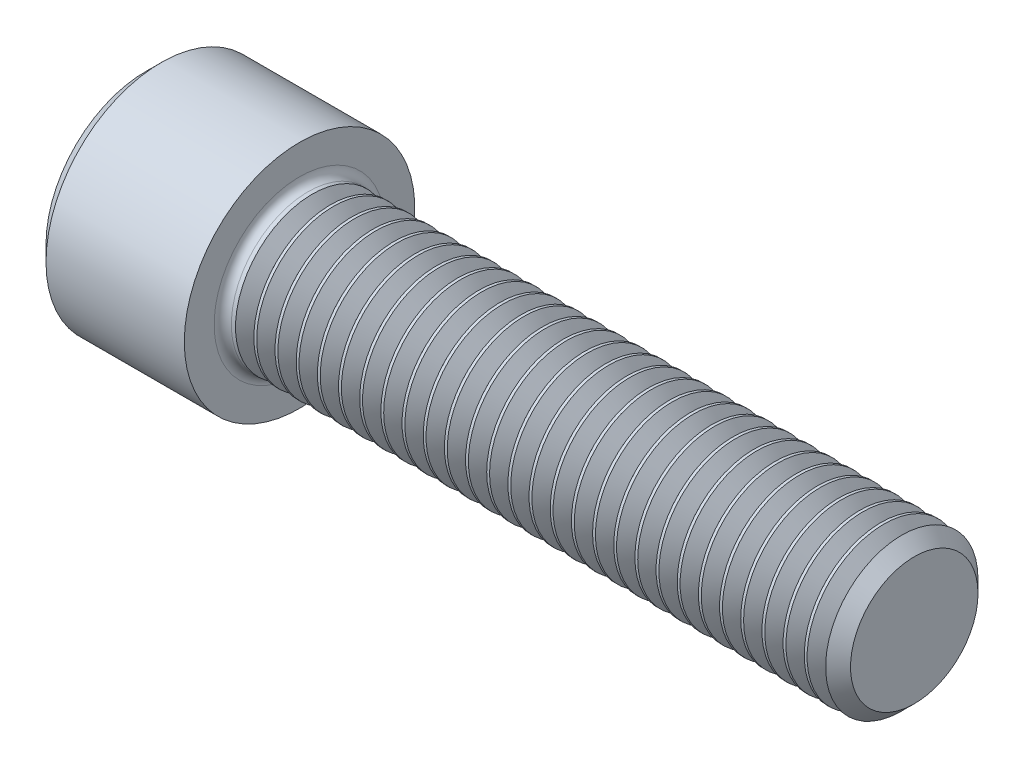
from build123d import *

# Parameters (mm, degrees)
SKETCH1_W            = 6.35
SKETCH1_H            = 4.7625
SKETCH2_R            = 3.175
BOSS_EXTRUDE1_DEPTH  = 0.527953718
SKETCH3_R            = 3.175
BOSS_EXTRUDE2_DEPTH  = 0.378826282
BOSS_EXTRUDE2_TAPER  = 55
SKETCH4_R            = 2.63398
BOSS_EXTRUDE3_DEPTH  = 0.378826282
BOSS_EXTRUDE3_DRAFT  = -55
SKETCH5_R            = 3.175
BOSS_EXTRUDE4_DEPTH  = 0.117105292
SKETCH6_R            = 3.175
BOSS_EXTRUDE5_DEPTH  = 0.378826282
BOSS_EXTRUDE5_TAPER  = 54.999999998
SKETCH7_R            = 2.63398
BOSS_EXTRUDE6_DEPTH  = 0.378826282
BOSS_EXTRUDE6_DRAFT  = -55.000000004
SKETCH8_R            = 3.175
BOSS_EXTRUDE7_DEPTH  = 0.117105293
SKETCH9_R            = 3.175
BOSS_EXTRUDE8_DEPTH  = 0.378826282
BOSS_EXTRUDE8_TAPER  = 54.999999998
SKETCH10_R           = 2.63398
BOSS_EXTRUDE9_DEPTH  = 0.378826282
BOSS_EXTRUDE9_DRAFT  = -55.000000004
SKETCH11_R           = 3.175
BOSS_EXTRUDE10_DEPTH = 0.117105292
SKETCH12_R           = 3.175
BOSS_EXTRUDE11_DEPTH = 0.378826282
BOSS_EXTRUDE11_TAPER = 54.999999998
SKETCH13_R           = 2.63398
BOSS_EXTRUDE12_DEPTH = 0.378826282
BOSS_EXTRUDE12_DRAFT = -55.000000004
SKETCH14_R           = 3.175
BOSS_EXTRUDE13_DEPTH = 0.117105292
SKETCH15_R           = 3.175
BOSS_EXTRUDE14_DEPTH = 0.378826282
BOSS_EXTRUDE14_TAPER = 54.999999998
SKETCH16_R           = 2.63398
BOSS_EXTRUDE15_DEPTH = 0.378826282
BOSS_EXTRUDE15_DRAFT = -55.000000004
SKETCH17_R           = 3.175
BOSS_EXTRUDE16_DEPTH = 0.117105293
SKETCH18_R           = 3.175
BOSS_EXTRUDE17_DEPTH = 0.378826282
BOSS_EXTRUDE17_TAPER = 54.999999998
SKETCH19_R           = 2.63398
BOSS_EXTRUDE18_DEPTH = 0.378826282
BOSS_EXTRUDE18_DRAFT = -55.000000004
SKETCH20_R           = 3.175
BOSS_EXTRUDE19_DEPTH = 0.117105292
SKETCH21_R           = 3.175
BOSS_EXTRUDE20_DEPTH = 0.378826282
BOSS_EXTRUDE20_TAPER = 54.999999998
SKETCH22_R           = 2.63398
BOSS_EXTRUDE21_DEPTH = 0.378826282
BOSS_EXTRUDE21_DRAFT = -55.000000004
SKETCH23_R           = 3.175
BOSS_EXTRUDE22_DEPTH = 0.117105292
SKETCH24_R           = 3.175
BOSS_EXTRUDE23_DEPTH = 0.378826282
BOSS_EXTRUDE23_TAPER = 54.999999998
SKETCH25_R           = 2.63398
BOSS_EXTRUDE24_DEPTH = 0.378826282
BOSS_EXTRUDE24_DRAFT = -55.000000004
SKETCH26_R           = 3.175
BOSS_EXTRUDE25_DEPTH = 0.117105293
SKETCH27_R           = 3.175
BOSS_EXTRUDE26_DEPTH = 0.378826282
BOSS_EXTRUDE26_TAPER = 54.999999998
SKETCH28_R           = 2.63398
BOSS_EXTRUDE27_DEPTH = 0.378826282
BOSS_EXTRUDE27_DRAFT = -55.000000004
SKETCH29_R           = 3.175
BOSS_EXTRUDE28_DEPTH = 0.117105292
SKETCH30_R           = 3.175
BOSS_EXTRUDE29_DEPTH = 0.378826282
BOSS_EXTRUDE29_TAPER = 54.999999998
SKETCH31_R           = 2.63398
BOSS_EXTRUDE30_DEPTH = 0.378826282
BOSS_EXTRUDE30_DRAFT = -55.000000004
SKETCH32_R           = 3.175
BOSS_EXTRUDE31_DEPTH = 0.117105292
SKETCH33_R           = 3.175
BOSS_EXTRUDE32_DEPTH = 0.378826282
BOSS_EXTRUDE32_TAPER = 54.999999998
SKETCH34_R           = 2.63398
BOSS_EXTRUDE33_DEPTH = 0.378826282
BOSS_EXTRUDE33_DRAFT = -55.000000004
SKETCH35_R           = 3.175
BOSS_EXTRUDE34_DEPTH = 0.117105293
SKETCH36_R           = 3.175
BOSS_EXTRUDE35_DEPTH = 0.378826282
BOSS_EXTRUDE35_TAPER = 54.999999998
SKETCH37_R           = 2.63398
BOSS_EXTRUDE36_DEPTH = 0.378826282
BOSS_EXTRUDE36_DRAFT = -55.000000004
SKETCH38_R           = 3.175
BOSS_EXTRUDE37_DEPTH = 0.117105292
SKETCH39_R           = 3.175
BOSS_EXTRUDE38_DEPTH = 0.378826282
BOSS_EXTRUDE38_TAPER = 54.999999998
SKETCH40_R           = 2.63398
BOSS_EXTRUDE39_DEPTH = 0.378826282
BOSS_EXTRUDE39_DRAFT = -55.000000004
SKETCH41_R           = 3.175
BOSS_EXTRUDE40_DEPTH = 0.117105292
SKETCH42_R           = 3.175
BOSS_EXTRUDE41_DEPTH = 0.378826282
BOSS_EXTRUDE41_TAPER = 54.999999998
SKETCH43_R           = 2.63398
BOSS_EXTRUDE42_DEPTH = 0.378826282
BOSS_EXTRUDE42_DRAFT = -55.000000004
SKETCH44_R           = 3.175
BOSS_EXTRUDE43_DEPTH = 0.117105293
SKETCH45_R           = 3.175
BOSS_EXTRUDE44_DEPTH = 0.378826282
BOSS_EXTRUDE44_TAPER = 54.999999998
SKETCH46_R           = 2.63398
BOSS_EXTRUDE45_DEPTH = 0.378826282
BOSS_EXTRUDE45_DRAFT = -55.000000004
SKETCH47_R           = 3.175
BOSS_EXTRUDE46_DEPTH = 0.117105292
SKETCH48_R           = 3.175
BOSS_EXTRUDE47_DEPTH = 0.378826282
BOSS_EXTRUDE47_TAPER = 54.999999998
SKETCH49_R           = 2.63398
BOSS_EXTRUDE48_DEPTH = 0.378826282
BOSS_EXTRUDE48_DRAFT = -55.000000004
SKETCH50_R           = 3.175
BOSS_EXTRUDE49_DEPTH = 0.117105292
SKETCH51_R           = 3.175
BOSS_EXTRUDE50_DEPTH = 0.378826282
BOSS_EXTRUDE50_TAPER = 54.999999998
SKETCH52_R           = 2.63398
BOSS_EXTRUDE51_DEPTH = 0.378826282
BOSS_EXTRUDE51_DRAFT = -55.000000004
SKETCH53_R           = 3.175
BOSS_EXTRUDE52_DEPTH = 0.117105293
SKETCH54_R           = 3.175
BOSS_EXTRUDE53_DEPTH = 0.378826282
BOSS_EXTRUDE53_TAPER = 54.999999998
SKETCH55_R           = 2.63398
BOSS_EXTRUDE54_DEPTH = 0.378826282
BOSS_EXTRUDE54_DRAFT = -55.000000004
SKETCH56_R           = 3.175
BOSS_EXTRUDE55_DEPTH = 0.117105292
SKETCH57_R           = 3.175
BOSS_EXTRUDE56_DEPTH = 0.378826282
BOSS_EXTRUDE56_TAPER = 54.999999998
SKETCH58_R           = 2.63398
BOSS_EXTRUDE57_DEPTH = 0.378826282
BOSS_EXTRUDE57_DRAFT = -55.000000004
SKETCH59_R           = 3.175
BOSS_EXTRUDE58_DEPTH = 0.117105292
SKETCH60_R           = 3.175
BOSS_EXTRUDE59_DEPTH = 0.378826282
BOSS_EXTRUDE59_TAPER = 54.999999998
SKETCH61_R           = 2.63398
BOSS_EXTRUDE60_DEPTH = 0.378826282
BOSS_EXTRUDE60_DRAFT = -55.000000004
SKETCH62_R           = 3.175
BOSS_EXTRUDE61_DEPTH = 0.117105293
SKETCH63_R           = 3.175
BOSS_EXTRUDE62_DEPTH = 0.378826282
BOSS_EXTRUDE62_TAPER = 54.999999998
SKETCH64_R           = 2.63398
BOSS_EXTRUDE63_DEPTH = 0.378826282
BOSS_EXTRUDE63_DRAFT = -55.000000004
SKETCH65_R           = 3.175
BOSS_EXTRUDE64_DEPTH = 0.117105292
SKETCH66_R           = 3.175
BOSS_EXTRUDE65_DEPTH = 0.378826282
BOSS_EXTRUDE65_TAPER = 54.999999998
SKETCH67_R           = 2.63398
BOSS_EXTRUDE66_DEPTH = 0.378826282
BOSS_EXTRUDE66_DRAFT = -55.000000004
SKETCH68_R           = 3.175
BOSS_EXTRUDE67_DEPTH = 0.117105292
SKETCH69_R           = 3.175
BOSS_EXTRUDE68_DEPTH = 0.378826282
BOSS_EXTRUDE68_TAPER = 54.999999998
SKETCH70_R           = 2.63398
BOSS_EXTRUDE69_DEPTH = 0.378826282
BOSS_EXTRUDE69_DRAFT = -55.000000004
SKETCH71_R           = 3.175
BOSS_EXTRUDE70_DEPTH = 0.117105293
SKETCH72_R           = 3.175
BOSS_EXTRUDE71_DEPTH = 0.378826282
BOSS_EXTRUDE71_TAPER = 54.999999998
SKETCH73_R           = 2.63398
BOSS_EXTRUDE72_DEPTH = 0.378826282
BOSS_EXTRUDE72_DRAFT = -55.000000004
SKETCH74_R           = 3.175
BOSS_EXTRUDE73_DEPTH = 0.117105292
SKETCH75_R           = 3.175
BOSS_EXTRUDE74_DEPTH = 0.378826282
BOSS_EXTRUDE74_TAPER = 54.999999998
SKETCH76_R           = 2.63398
BOSS_EXTRUDE75_DEPTH = 0.378826282
BOSS_EXTRUDE75_DRAFT = -55.000000004
SKETCH77_R           = 3.175
BOSS_EXTRUDE76_DEPTH = 0.117105292
SKETCH78_R           = 3.175
BOSS_EXTRUDE77_DEPTH = 0.378826282
BOSS_EXTRUDE77_TAPER = 54.999999998
SKETCH79_R           = 2.63398
BOSS_EXTRUDE78_DEPTH = 0.378826282
BOSS_EXTRUDE78_DRAFT = -55.000000004
SKETCH80_R           = 3.175
BOSS_EXTRUDE79_DEPTH = 0.117105293
SKETCH81_R           = 3.175
BOSS_EXTRUDE80_DEPTH = 0.378826282
BOSS_EXTRUDE80_TAPER = 54.999999998
SKETCH82_R           = 2.63398
BOSS_EXTRUDE81_DEPTH = 0.378826282
BOSS_EXTRUDE81_DRAFT = -55.000000004
SKETCH83_R           = 3.175
BOSS_EXTRUDE82_DEPTH = 0.117105292
SKETCH84_R           = 3.175
BOSS_EXTRUDE83_DEPTH = 0.378826282
BOSS_EXTRUDE83_TAPER = 55
SKETCH85_R           = 2.63398
BOSS_EXTRUDE84_DEPTH = 0.360257223
BOSS_EXTRUDE84_DRAFT = -55.000000006
SKETCH86_R           = 3.148480634
BOSS_EXTRUDE85_DEPTH = 0.514500634
BOSS_EXTRUDE85_TAPER = 44.999999997
CUT_EXTRUDE1_DEPTH   = 3.048
CHAMFER1_SIZE        = 0.635
FILLET1_R            = 0.3556


with BuildPart() as part:
    # Sketch1 → Revolve1 (revolve)
    with BuildSketch(Plane(origin=(0, 0, 0), x_dir=(-1, 0, 0), z_dir=(0, 0, -1))):
        with Locations((-3.175, 2.38125)):
            Rectangle(SKETCH1_W, SKETCH1_H)
    revolve(axis=Axis((6.35, 0, 0), (-1, 0, 0)))

    # Sketch2 → Boss-Extrude1 (add)
    with BuildSketch(Plane(origin=(6.35, 0, 0), x_dir=(0, 0, -1), z_dir=(1, 0, 0))):
        Circle(SKETCH2_R)
    extrude(amount=BOSS_EXTRUDE1_DEPTH)

    # Sketch3 → Boss-Extrude2 (add)
    with BuildSketch(Plane(origin=(6.877953718, 0, 0), x_dir=(0, 0, -1), z_dir=(1, 0, 0))):
        Circle(SKETCH3_R)
    extrude(amount=BOSS_EXTRUDE2_DEPTH, taper=BOSS_EXTRUDE2_TAPER)


with BuildPart() as boss_extrude3_tool:
    # Sketch4 → Boss-Extrude3 (with draft: the straight prism first)
    with BuildSketch(Plane(origin=(7.25678, 0, 0), x_dir=(0, 0, -1), z_dir=(1, 0, 0))):
        Circle(SKETCH4_R)
    extrude(amount=BOSS_EXTRUDE3_DEPTH)
    # Boss-Extrude3: the draft: its side faces are tilted about the plane it starts from
    boss_extrude3_sides = [boss_extrude3_tool.faces().sort_by_distance(p)[0] for p in [
        (7.446193141, 0, 2.63398),
    ]]
    draft(boss_extrude3_sides, Plane(origin=(7.25678, 0, 0), x_dir=(0, 0, -1), z_dir=(1, 0, 0)), BOSS_EXTRUDE3_DRAFT)


with BuildPart() as part_1:
    add(part.part)

    # Boss-Extrude3: add boss_extrude3_tool
    add(boss_extrude3_tool.part)

    # Sketch5 → Boss-Extrude4 (add)
    with BuildSketch(Plane(origin=(7.635606282, 0, 0), x_dir=(0, 0, -1), z_dir=(1, 0, 0))):
        Circle(SKETCH5_R)
    extrude(amount=BOSS_EXTRUDE4_DEPTH)

    # Sketch6 → Boss-Extrude5 (add)
    with BuildSketch(Plane(origin=(7.752711575, 0, 0), x_dir=(0, 0, -1), z_dir=(1, 0, 0))):
        Circle(SKETCH6_R)
    extrude(amount=BOSS_EXTRUDE5_DEPTH, taper=BOSS_EXTRUDE5_TAPER)


with BuildPart() as boss_extrude6_tool:
    # Sketch7 → Boss-Extrude6 (with draft: the straight prism first)
    with BuildSketch(Plane(origin=(8.131537857, 0, 0), x_dir=(0, 0, -1), z_dir=(1, 0, 0))):
        Circle(SKETCH7_R)
    extrude(amount=BOSS_EXTRUDE6_DEPTH)
    # Boss-Extrude6: the draft: its side faces are tilted about the plane it starts from
    boss_extrude6_sides = [boss_extrude6_tool.faces().sort_by_distance(p)[0] for p in [
        (8.320950998, 0, 2.63398),
    ]]
    draft(boss_extrude6_sides, Plane(origin=(8.131537857, 0, 0), x_dir=(0, 0, -1), z_dir=(1, 0, 0)), BOSS_EXTRUDE6_DRAFT)


with BuildPart() as part_2:
    add(part_1.part)

    # Boss-Extrude6: add boss_extrude6_tool
    add(boss_extrude6_tool.part)

    # Sketch8 → Boss-Extrude7 (add)
    with BuildSketch(Plane(origin=(8.510364139, 0, 0), x_dir=(0, 0, -1), z_dir=(1, 0, 0))):
        Circle(SKETCH8_R)
    extrude(amount=BOSS_EXTRUDE7_DEPTH)

    # Sketch9 → Boss-Extrude8 (add)
    with BuildSketch(Plane(origin=(8.627469432, 0, 0), x_dir=(0, 0, -1), z_dir=(1, 0, 0))):
        Circle(SKETCH9_R)
    extrude(amount=BOSS_EXTRUDE8_DEPTH, taper=BOSS_EXTRUDE8_TAPER)


with BuildPart() as boss_extrude9_tool:
    # Sketch10 → Boss-Extrude9 (with draft: the straight prism first)
    with BuildSketch(Plane(origin=(9.006295714, 0, 0), x_dir=(0, 0, -1), z_dir=(1, 0, 0))):
        Circle(SKETCH10_R)
    extrude(amount=BOSS_EXTRUDE9_DEPTH)
    # Boss-Extrude9: the draft: its side faces are tilted about the plane it starts from
    boss_extrude9_sides = [boss_extrude9_tool.faces().sort_by_distance(p)[0] for p in [
        (9.195708855, 0, 2.63398),
    ]]
    draft(boss_extrude9_sides, Plane(origin=(9.006295714, 0, 0), x_dir=(0, 0, -1), z_dir=(1, 0, 0)), BOSS_EXTRUDE9_DRAFT)


with BuildPart() as part_3:
    add(part_2.part)

    # Boss-Extrude9: add boss_extrude9_tool
    add(boss_extrude9_tool.part)

    # Sketch11 → Boss-Extrude10 (add)
    with BuildSketch(Plane(origin=(9.385121997, 0, 0), x_dir=(0, 0, -1), z_dir=(1, 0, 0))):
        Circle(SKETCH11_R)
    extrude(amount=BOSS_EXTRUDE10_DEPTH)

    # Sketch12 → Boss-Extrude11 (add)
    with BuildSketch(Plane(origin=(9.502227289, 0, 0), x_dir=(0, 0, -1), z_dir=(1, 0, 0))):
        Circle(SKETCH12_R)
    extrude(amount=BOSS_EXTRUDE11_DEPTH, taper=BOSS_EXTRUDE11_TAPER)


with BuildPart() as boss_extrude12_tool:
    # Sketch13 → Boss-Extrude12 (with draft: the straight prism first)
    with BuildSketch(Plane(origin=(9.881053571, 0, 0), x_dir=(0, 0, -1), z_dir=(1, 0, 0))):
        Circle(SKETCH13_R)
    extrude(amount=BOSS_EXTRUDE12_DEPTH)
    # Boss-Extrude12: the draft: its side faces are tilted about the plane it starts from
    boss_extrude12_sides = [boss_extrude12_tool.faces().sort_by_distance(p)[0] for p in [
        (10.070466713, 0, 2.63398),
    ]]
    draft(boss_extrude12_sides, Plane(origin=(9.881053571, 0, 0), x_dir=(0, 0, -1), z_dir=(1, 0, 0)), BOSS_EXTRUDE12_DRAFT)


with BuildPart() as part_4:
    add(part_3.part)

    # Boss-Extrude12: add boss_extrude12_tool
    add(boss_extrude12_tool.part)

    # Sketch14 → Boss-Extrude13 (add)
    with BuildSketch(Plane(origin=(10.259879854, 0, 0), x_dir=(0, 0, -1), z_dir=(1, 0, 0))):
        Circle(SKETCH14_R)
    extrude(amount=BOSS_EXTRUDE13_DEPTH)

    # Sketch15 → Boss-Extrude14 (add)
    with BuildSketch(Plane(origin=(10.376985146, 0, 0), x_dir=(0, 0, -1), z_dir=(1, 0, 0))):
        Circle(SKETCH15_R)
    extrude(amount=BOSS_EXTRUDE14_DEPTH, taper=BOSS_EXTRUDE14_TAPER)


with BuildPart() as boss_extrude15_tool:
    # Sketch16 → Boss-Extrude15 (with draft: the straight prism first)
    with BuildSketch(Plane(origin=(10.755811429, 0, 0), x_dir=(0, 0, -1), z_dir=(1, 0, 0))):
        Circle(SKETCH16_R)
    extrude(amount=BOSS_EXTRUDE15_DEPTH)
    # Boss-Extrude15: the draft: its side faces are tilted about the plane it starts from
    boss_extrude15_sides = [boss_extrude15_tool.faces().sort_by_distance(p)[0] for p in [
        (10.94522457, 0, 2.63398),
    ]]
    draft(boss_extrude15_sides, Plane(origin=(10.755811429, 0, 0), x_dir=(0, 0, -1), z_dir=(1, 0, 0)), BOSS_EXTRUDE15_DRAFT)


with BuildPart() as part_5:
    add(part_4.part)

    # Boss-Extrude15: add boss_extrude15_tool
    add(boss_extrude15_tool.part)

    # Sketch17 → Boss-Extrude16 (add)
    with BuildSketch(Plane(origin=(11.134637711, 0, 0), x_dir=(0, 0, -1), z_dir=(1, 0, 0))):
        Circle(SKETCH17_R)
    extrude(amount=BOSS_EXTRUDE16_DEPTH)

    # Sketch18 → Boss-Extrude17 (add)
    with BuildSketch(Plane(origin=(11.251743003, 0, 0), x_dir=(0, 0, -1), z_dir=(1, 0, 0))):
        Circle(SKETCH18_R)
    extrude(amount=BOSS_EXTRUDE17_DEPTH, taper=BOSS_EXTRUDE17_TAPER)


with BuildPart() as boss_extrude18_tool:
    # Sketch19 → Boss-Extrude18 (with draft: the straight prism first)
    with BuildSketch(Plane(origin=(11.630569286, 0, 0), x_dir=(0, 0, -1), z_dir=(1, 0, 0))):
        Circle(SKETCH19_R)
    extrude(amount=BOSS_EXTRUDE18_DEPTH)
    # Boss-Extrude18: the draft: its side faces are tilted about the plane it starts from
    boss_extrude18_sides = [boss_extrude18_tool.faces().sort_by_distance(p)[0] for p in [
        (11.819982427, 0, 2.63398),
    ]]
    draft(boss_extrude18_sides, Plane(origin=(11.630569286, 0, 0), x_dir=(0, 0, -1), z_dir=(1, 0, 0)), BOSS_EXTRUDE18_DRAFT)


with BuildPart() as part_6:
    add(part_5.part)

    # Boss-Extrude18: add boss_extrude18_tool
    add(boss_extrude18_tool.part)

    # Sketch20 → Boss-Extrude19 (add)
    with BuildSketch(Plane(origin=(12.009395568, 0, 0), x_dir=(0, 0, -1), z_dir=(1, 0, 0))):
        Circle(SKETCH20_R)
    extrude(amount=BOSS_EXTRUDE19_DEPTH)

    # Sketch21 → Boss-Extrude20 (add)
    with BuildSketch(Plane(origin=(12.126500861, 0, 0), x_dir=(0, 0, -1), z_dir=(1, 0, 0))):
        Circle(SKETCH21_R)
    extrude(amount=BOSS_EXTRUDE20_DEPTH, taper=BOSS_EXTRUDE20_TAPER)


with BuildPart() as boss_extrude21_tool:
    # Sketch22 → Boss-Extrude21 (with draft: the straight prism first)
    with BuildSketch(Plane(origin=(12.505327143, 0, 0), x_dir=(0, 0, -1), z_dir=(1, 0, 0))):
        Circle(SKETCH22_R)
    extrude(amount=BOSS_EXTRUDE21_DEPTH)
    # Boss-Extrude21: the draft: its side faces are tilted about the plane it starts from
    boss_extrude21_sides = [boss_extrude21_tool.faces().sort_by_distance(p)[0] for p in [
        (12.694740284, 0, 2.63398),
    ]]
    draft(boss_extrude21_sides, Plane(origin=(12.505327143, 0, 0), x_dir=(0, 0, -1), z_dir=(1, 0, 0)), BOSS_EXTRUDE21_DRAFT)


with BuildPart() as part_7:
    add(part_6.part)

    # Boss-Extrude21: add boss_extrude21_tool
    add(boss_extrude21_tool.part)

    # Sketch23 → Boss-Extrude22 (add)
    with BuildSketch(Plane(origin=(12.884153425, 0, 0), x_dir=(0, 0, -1), z_dir=(1, 0, 0))):
        Circle(SKETCH23_R)
    extrude(amount=BOSS_EXTRUDE22_DEPTH)

    # Sketch24 → Boss-Extrude23 (add)
    with BuildSketch(Plane(origin=(13.001258718, 0, 0), x_dir=(0, 0, -1), z_dir=(1, 0, 0))):
        Circle(SKETCH24_R)
    extrude(amount=BOSS_EXTRUDE23_DEPTH, taper=BOSS_EXTRUDE23_TAPER)


with BuildPart() as boss_extrude24_tool:
    # Sketch25 → Boss-Extrude24 (with draft: the straight prism first)
    with BuildSketch(Plane(origin=(13.380085, 0, 0), x_dir=(0, 0, -1), z_dir=(1, 0, 0))):
        Circle(SKETCH25_R)
    extrude(amount=BOSS_EXTRUDE24_DEPTH)
    # Boss-Extrude24: the draft: its side faces are tilted about the plane it starts from
    boss_extrude24_sides = [boss_extrude24_tool.faces().sort_by_distance(p)[0] for p in [
        (13.569498141, 0, 2.63398),
    ]]
    draft(boss_extrude24_sides, Plane(origin=(13.380085, 0, 0), x_dir=(0, 0, -1), z_dir=(1, 0, 0)), BOSS_EXTRUDE24_DRAFT)


with BuildPart() as part_8:
    add(part_7.part)

    # Boss-Extrude24: add boss_extrude24_tool
    add(boss_extrude24_tool.part)

    # Sketch26 → Boss-Extrude25 (add)
    with BuildSketch(Plane(origin=(13.758911282, 0, 0), x_dir=(0, 0, -1), z_dir=(1, 0, 0))):
        Circle(SKETCH26_R)
    extrude(amount=BOSS_EXTRUDE25_DEPTH)

    # Sketch27 → Boss-Extrude26 (add)
    with BuildSketch(Plane(origin=(13.876016575, 0, 0), x_dir=(0, 0, -1), z_dir=(1, 0, 0))):
        Circle(SKETCH27_R)
    extrude(amount=BOSS_EXTRUDE26_DEPTH, taper=BOSS_EXTRUDE26_TAPER)


with BuildPart() as boss_extrude27_tool:
    # Sketch28 → Boss-Extrude27 (with draft: the straight prism first)
    with BuildSketch(Plane(origin=(14.254842857, 0, 0), x_dir=(0, 0, -1), z_dir=(1, 0, 0))):
        Circle(SKETCH28_R)
    extrude(amount=BOSS_EXTRUDE27_DEPTH)
    # Boss-Extrude27: the draft: its side faces are tilted about the plane it starts from
    boss_extrude27_sides = [boss_extrude27_tool.faces().sort_by_distance(p)[0] for p in [
        (14.444255998, 0, 2.63398),
    ]]
    draft(boss_extrude27_sides, Plane(origin=(14.254842857, 0, 0), x_dir=(0, 0, -1), z_dir=(1, 0, 0)), BOSS_EXTRUDE27_DRAFT)


with BuildPart() as part_9:
    add(part_8.part)

    # Boss-Extrude27: add boss_extrude27_tool
    add(boss_extrude27_tool.part)

    # Sketch29 → Boss-Extrude28 (add)
    with BuildSketch(Plane(origin=(14.633669139, 0, 0), x_dir=(0, 0, -1), z_dir=(1, 0, 0))):
        Circle(SKETCH29_R)
    extrude(amount=BOSS_EXTRUDE28_DEPTH)

    # Sketch30 → Boss-Extrude29 (add)
    with BuildSketch(Plane(origin=(14.750774432, 0, 0), x_dir=(0, 0, -1), z_dir=(1, 0, 0))):
        Circle(SKETCH30_R)
    extrude(amount=BOSS_EXTRUDE29_DEPTH, taper=BOSS_EXTRUDE29_TAPER)


with BuildPart() as boss_extrude30_tool:
    # Sketch31 → Boss-Extrude30 (with draft: the straight prism first)
    with BuildSketch(Plane(origin=(15.129600714, 0, 0), x_dir=(0, 0, -1), z_dir=(1, 0, 0))):
        Circle(SKETCH31_R)
    extrude(amount=BOSS_EXTRUDE30_DEPTH)
    # Boss-Extrude30: the draft: its side faces are tilted about the plane it starts from
    boss_extrude30_sides = [boss_extrude30_tool.faces().sort_by_distance(p)[0] for p in [
        (15.319013855, 0, 2.63398),
    ]]
    draft(boss_extrude30_sides, Plane(origin=(15.129600714, 0, 0), x_dir=(0, 0, -1), z_dir=(1, 0, 0)), BOSS_EXTRUDE30_DRAFT)


with BuildPart() as part_10:
    add(part_9.part)

    # Boss-Extrude30: add boss_extrude30_tool
    add(boss_extrude30_tool.part)

    # Sketch32 → Boss-Extrude31 (add)
    with BuildSketch(Plane(origin=(15.508426997, 0, 0), x_dir=(0, 0, -1), z_dir=(1, 0, 0))):
        Circle(SKETCH32_R)
    extrude(amount=BOSS_EXTRUDE31_DEPTH)

    # Sketch33 → Boss-Extrude32 (add)
    with BuildSketch(Plane(origin=(15.625532289, 0, 0), x_dir=(0, 0, -1), z_dir=(1, 0, 0))):
        Circle(SKETCH33_R)
    extrude(amount=BOSS_EXTRUDE32_DEPTH, taper=BOSS_EXTRUDE32_TAPER)


with BuildPart() as boss_extrude33_tool:
    # Sketch34 → Boss-Extrude33 (with draft: the straight prism first)
    with BuildSketch(Plane(origin=(16.004358571, 0, 0), x_dir=(0, 0, -1), z_dir=(1, 0, 0))):
        Circle(SKETCH34_R)
    extrude(amount=BOSS_EXTRUDE33_DEPTH)
    # Boss-Extrude33: the draft: its side faces are tilted about the plane it starts from
    boss_extrude33_sides = [boss_extrude33_tool.faces().sort_by_distance(p)[0] for p in [
        (16.193771713, 0, 2.63398),
    ]]
    draft(boss_extrude33_sides, Plane(origin=(16.004358571, 0, 0), x_dir=(0, 0, -1), z_dir=(1, 0, 0)), BOSS_EXTRUDE33_DRAFT)


with BuildPart() as part_11:
    add(part_10.part)

    # Boss-Extrude33: add boss_extrude33_tool
    add(boss_extrude33_tool.part)

    # Sketch35 → Boss-Extrude34 (add)
    with BuildSketch(Plane(origin=(16.383184854, 0, 0), x_dir=(0, 0, -1), z_dir=(1, 0, 0))):
        Circle(SKETCH35_R)
    extrude(amount=BOSS_EXTRUDE34_DEPTH)

    # Sketch36 → Boss-Extrude35 (add)
    with BuildSketch(Plane(origin=(16.500290146, 0, 0), x_dir=(0, 0, -1), z_dir=(1, 0, 0))):
        Circle(SKETCH36_R)
    extrude(amount=BOSS_EXTRUDE35_DEPTH, taper=BOSS_EXTRUDE35_TAPER)


with BuildPart() as boss_extrude36_tool:
    # Sketch37 → Boss-Extrude36 (with draft: the straight prism first)
    with BuildSketch(Plane(origin=(16.879116429, 0, 0), x_dir=(0, 0, -1), z_dir=(1, 0, 0))):
        Circle(SKETCH37_R)
    extrude(amount=BOSS_EXTRUDE36_DEPTH)
    # Boss-Extrude36: the draft: its side faces are tilted about the plane it starts from
    boss_extrude36_sides = [boss_extrude36_tool.faces().sort_by_distance(p)[0] for p in [
        (17.06852957, 0, 2.63398),
    ]]
    draft(boss_extrude36_sides, Plane(origin=(16.879116429, 0, 0), x_dir=(0, 0, -1), z_dir=(1, 0, 0)), BOSS_EXTRUDE36_DRAFT)


with BuildPart() as part_12:
    add(part_11.part)

    # Boss-Extrude36: add boss_extrude36_tool
    add(boss_extrude36_tool.part)

    # Sketch38 → Boss-Extrude37 (add)
    with BuildSketch(Plane(origin=(17.257942711, 0, 0), x_dir=(0, 0, -1), z_dir=(1, 0, 0))):
        Circle(SKETCH38_R)
    extrude(amount=BOSS_EXTRUDE37_DEPTH)

    # Sketch39 → Boss-Extrude38 (add)
    with BuildSketch(Plane(origin=(17.375048003, 0, 0), x_dir=(0, 0, -1), z_dir=(1, 0, 0))):
        Circle(SKETCH39_R)
    extrude(amount=BOSS_EXTRUDE38_DEPTH, taper=BOSS_EXTRUDE38_TAPER)


with BuildPart() as boss_extrude39_tool:
    # Sketch40 → Boss-Extrude39 (with draft: the straight prism first)
    with BuildSketch(Plane(origin=(17.753874286, 0, 0), x_dir=(0, 0, -1), z_dir=(1, 0, 0))):
        Circle(SKETCH40_R)
    extrude(amount=BOSS_EXTRUDE39_DEPTH)
    # Boss-Extrude39: the draft: its side faces are tilted about the plane it starts from
    boss_extrude39_sides = [boss_extrude39_tool.faces().sort_by_distance(p)[0] for p in [
        (17.943287427, 0, 2.63398),
    ]]
    draft(boss_extrude39_sides, Plane(origin=(17.753874286, 0, 0), x_dir=(0, 0, -1), z_dir=(1, 0, 0)), BOSS_EXTRUDE39_DRAFT)


with BuildPart() as part_13:
    add(part_12.part)

    # Boss-Extrude39: add boss_extrude39_tool
    add(boss_extrude39_tool.part)

    # Sketch41 → Boss-Extrude40 (add)
    with BuildSketch(Plane(origin=(18.132700568, 0, 0), x_dir=(0, 0, -1), z_dir=(1, 0, 0))):
        Circle(SKETCH41_R)
    extrude(amount=BOSS_EXTRUDE40_DEPTH)

    # Sketch42 → Boss-Extrude41 (add)
    with BuildSketch(Plane(origin=(18.249805861, 0, 0), x_dir=(0, 0, -1), z_dir=(1, 0, 0))):
        Circle(SKETCH42_R)
    extrude(amount=BOSS_EXTRUDE41_DEPTH, taper=BOSS_EXTRUDE41_TAPER)


with BuildPart() as boss_extrude42_tool:
    # Sketch43 → Boss-Extrude42 (with draft: the straight prism first)
    with BuildSketch(Plane(origin=(18.628632143, 0, 0), x_dir=(0, 0, -1), z_dir=(1, 0, 0))):
        Circle(SKETCH43_R)
    extrude(amount=BOSS_EXTRUDE42_DEPTH)
    # Boss-Extrude42: the draft: its side faces are tilted about the plane it starts from
    boss_extrude42_sides = [boss_extrude42_tool.faces().sort_by_distance(p)[0] for p in [
        (18.818045284, 0, 2.63398),
    ]]
    draft(boss_extrude42_sides, Plane(origin=(18.628632143, 0, 0), x_dir=(0, 0, -1), z_dir=(1, 0, 0)), BOSS_EXTRUDE42_DRAFT)


with BuildPart() as part_14:
    add(part_13.part)

    # Boss-Extrude42: add boss_extrude42_tool
    add(boss_extrude42_tool.part)

    # Sketch44 → Boss-Extrude43 (add)
    with BuildSketch(Plane(origin=(19.007458425, 0, 0), x_dir=(0, 0, -1), z_dir=(1, 0, 0))):
        Circle(SKETCH44_R)
    extrude(amount=BOSS_EXTRUDE43_DEPTH)

    # Sketch45 → Boss-Extrude44 (add)
    with BuildSketch(Plane(origin=(19.124563718, 0, 0), x_dir=(0, 0, -1), z_dir=(1, 0, 0))):
        Circle(SKETCH45_R)
    extrude(amount=BOSS_EXTRUDE44_DEPTH, taper=BOSS_EXTRUDE44_TAPER)


with BuildPart() as boss_extrude45_tool:
    # Sketch46 → Boss-Extrude45 (with draft: the straight prism first)
    with BuildSketch(Plane(origin=(19.50339, 0, 0), x_dir=(0, 0, -1), z_dir=(1, 0, 0))):
        Circle(SKETCH46_R)
    extrude(amount=BOSS_EXTRUDE45_DEPTH)
    # Boss-Extrude45: the draft: its side faces are tilted about the plane it starts from
    boss_extrude45_sides = [boss_extrude45_tool.faces().sort_by_distance(p)[0] for p in [
        (19.692803141, 0, 2.63398),
    ]]
    draft(boss_extrude45_sides, Plane(origin=(19.50339, 0, 0), x_dir=(0, 0, -1), z_dir=(1, 0, 0)), BOSS_EXTRUDE45_DRAFT)


with BuildPart() as part_15:
    add(part_14.part)

    # Boss-Extrude45: add boss_extrude45_tool
    add(boss_extrude45_tool.part)

    # Sketch47 → Boss-Extrude46 (add)
    with BuildSketch(Plane(origin=(19.882216282, 0, 0), x_dir=(0, 0, -1), z_dir=(1, 0, 0))):
        Circle(SKETCH47_R)
    extrude(amount=BOSS_EXTRUDE46_DEPTH)

    # Sketch48 → Boss-Extrude47 (add)
    with BuildSketch(Plane(origin=(19.999321575, 0, 0), x_dir=(0, 0, -1), z_dir=(1, 0, 0))):
        Circle(SKETCH48_R)
    extrude(amount=BOSS_EXTRUDE47_DEPTH, taper=BOSS_EXTRUDE47_TAPER)


with BuildPart() as boss_extrude48_tool:
    # Sketch49 → Boss-Extrude48 (with draft: the straight prism first)
    with BuildSketch(Plane(origin=(20.378147857, 0, 0), x_dir=(0, 0, -1), z_dir=(1, 0, 0))):
        Circle(SKETCH49_R)
    extrude(amount=BOSS_EXTRUDE48_DEPTH)
    # Boss-Extrude48: the draft: its side faces are tilted about the plane it starts from
    boss_extrude48_sides = [boss_extrude48_tool.faces().sort_by_distance(p)[0] for p in [
        (20.567560998, 0, 2.63398),
    ]]
    draft(boss_extrude48_sides, Plane(origin=(20.378147857, 0, 0), x_dir=(0, 0, -1), z_dir=(1, 0, 0)), BOSS_EXTRUDE48_DRAFT)


with BuildPart() as part_16:
    add(part_15.part)

    # Boss-Extrude48: add boss_extrude48_tool
    add(boss_extrude48_tool.part)

    # Sketch50 → Boss-Extrude49 (add)
    with BuildSketch(Plane(origin=(20.756974139, 0, 0), x_dir=(0, 0, -1), z_dir=(1, 0, 0))):
        Circle(SKETCH50_R)
    extrude(amount=BOSS_EXTRUDE49_DEPTH)

    # Sketch51 → Boss-Extrude50 (add)
    with BuildSketch(Plane(origin=(20.874079432, 0, 0), x_dir=(0, 0, -1), z_dir=(1, 0, 0))):
        Circle(SKETCH51_R)
    extrude(amount=BOSS_EXTRUDE50_DEPTH, taper=BOSS_EXTRUDE50_TAPER)


with BuildPart() as boss_extrude51_tool:
    # Sketch52 → Boss-Extrude51 (with draft: the straight prism first)
    with BuildSketch(Plane(origin=(21.252905714, 0, 0), x_dir=(0, 0, -1), z_dir=(1, 0, 0))):
        Circle(SKETCH52_R)
    extrude(amount=BOSS_EXTRUDE51_DEPTH)
    # Boss-Extrude51: the draft: its side faces are tilted about the plane it starts from
    boss_extrude51_sides = [boss_extrude51_tool.faces().sort_by_distance(p)[0] for p in [
        (21.442318855, 0, 2.63398),
    ]]
    draft(boss_extrude51_sides, Plane(origin=(21.252905714, 0, 0), x_dir=(0, 0, -1), z_dir=(1, 0, 0)), BOSS_EXTRUDE51_DRAFT)


with BuildPart() as part_17:
    add(part_16.part)

    # Boss-Extrude51: add boss_extrude51_tool
    add(boss_extrude51_tool.part)

    # Sketch53 → Boss-Extrude52 (add)
    with BuildSketch(Plane(origin=(21.631731997, 0, 0), x_dir=(0, 0, -1), z_dir=(1, 0, 0))):
        Circle(SKETCH53_R)
    extrude(amount=BOSS_EXTRUDE52_DEPTH)

    # Sketch54 → Boss-Extrude53 (add)
    with BuildSketch(Plane(origin=(21.748837289, 0, 0), x_dir=(0, 0, -1), z_dir=(1, 0, 0))):
        Circle(SKETCH54_R)
    extrude(amount=BOSS_EXTRUDE53_DEPTH, taper=BOSS_EXTRUDE53_TAPER)


with BuildPart() as boss_extrude54_tool:
    # Sketch55 → Boss-Extrude54 (with draft: the straight prism first)
    with BuildSketch(Plane(origin=(22.127663571, 0, 0), x_dir=(0, 0, -1), z_dir=(1, 0, 0))):
        Circle(SKETCH55_R)
    extrude(amount=BOSS_EXTRUDE54_DEPTH)
    # Boss-Extrude54: the draft: its side faces are tilted about the plane it starts from
    boss_extrude54_sides = [boss_extrude54_tool.faces().sort_by_distance(p)[0] for p in [
        (22.317076713, 0, 2.63398),
    ]]
    draft(boss_extrude54_sides, Plane(origin=(22.127663571, 0, 0), x_dir=(0, 0, -1), z_dir=(1, 0, 0)), BOSS_EXTRUDE54_DRAFT)


with BuildPart() as part_18:
    add(part_17.part)

    # Boss-Extrude54: add boss_extrude54_tool
    add(boss_extrude54_tool.part)

    # Sketch56 → Boss-Extrude55 (add)
    with BuildSketch(Plane(origin=(22.506489854, 0, 0), x_dir=(0, 0, -1), z_dir=(1, 0, 0))):
        Circle(SKETCH56_R)
    extrude(amount=BOSS_EXTRUDE55_DEPTH)

    # Sketch57 → Boss-Extrude56 (add)
    with BuildSketch(Plane(origin=(22.623595146, 0, 0), x_dir=(0, 0, -1), z_dir=(1, 0, 0))):
        Circle(SKETCH57_R)
    extrude(amount=BOSS_EXTRUDE56_DEPTH, taper=BOSS_EXTRUDE56_TAPER)


with BuildPart() as boss_extrude57_tool:
    # Sketch58 → Boss-Extrude57 (with draft: the straight prism first)
    with BuildSketch(Plane(origin=(23.002421429, 0, 0), x_dir=(0, 0, -1), z_dir=(1, 0, 0))):
        Circle(SKETCH58_R)
    extrude(amount=BOSS_EXTRUDE57_DEPTH)
    # Boss-Extrude57: the draft: its side faces are tilted about the plane it starts from
    boss_extrude57_sides = [boss_extrude57_tool.faces().sort_by_distance(p)[0] for p in [
        (23.19183457, 0, 2.63398),
    ]]
    draft(boss_extrude57_sides, Plane(origin=(23.002421429, 0, 0), x_dir=(0, 0, -1), z_dir=(1, 0, 0)), BOSS_EXTRUDE57_DRAFT)


with BuildPart() as part_19:
    add(part_18.part)

    # Boss-Extrude57: add boss_extrude57_tool
    add(boss_extrude57_tool.part)

    # Sketch59 → Boss-Extrude58 (add)
    with BuildSketch(Plane(origin=(23.381247711, 0, 0), x_dir=(0, 0, -1), z_dir=(1, 0, 0))):
        Circle(SKETCH59_R)
    extrude(amount=BOSS_EXTRUDE58_DEPTH)

    # Sketch60 → Boss-Extrude59 (add)
    with BuildSketch(Plane(origin=(23.498353003, 0, 0), x_dir=(0, 0, -1), z_dir=(1, 0, 0))):
        Circle(SKETCH60_R)
    extrude(amount=BOSS_EXTRUDE59_DEPTH, taper=BOSS_EXTRUDE59_TAPER)


with BuildPart() as boss_extrude60_tool:
    # Sketch61 → Boss-Extrude60 (with draft: the straight prism first)
    with BuildSketch(Plane(origin=(23.877179286, 0, 0), x_dir=(0, 0, -1), z_dir=(1, 0, 0))):
        Circle(SKETCH61_R)
    extrude(amount=BOSS_EXTRUDE60_DEPTH)
    # Boss-Extrude60: the draft: its side faces are tilted about the plane it starts from
    boss_extrude60_sides = [boss_extrude60_tool.faces().sort_by_distance(p)[0] for p in [
        (24.066592427, 0, 2.63398),
    ]]
    draft(boss_extrude60_sides, Plane(origin=(23.877179286, 0, 0), x_dir=(0, 0, -1), z_dir=(1, 0, 0)), BOSS_EXTRUDE60_DRAFT)


with BuildPart() as part_20:
    add(part_19.part)

    # Boss-Extrude60: add boss_extrude60_tool
    add(boss_extrude60_tool.part)

    # Sketch62 → Boss-Extrude61 (add)
    with BuildSketch(Plane(origin=(24.256005568, 0, 0), x_dir=(0, 0, -1), z_dir=(1, 0, 0))):
        Circle(SKETCH62_R)
    extrude(amount=BOSS_EXTRUDE61_DEPTH)

    # Sketch63 → Boss-Extrude62 (add)
    with BuildSketch(Plane(origin=(24.373110861, 0, 0), x_dir=(0, 0, -1), z_dir=(1, 0, 0))):
        Circle(SKETCH63_R)
    extrude(amount=BOSS_EXTRUDE62_DEPTH, taper=BOSS_EXTRUDE62_TAPER)


with BuildPart() as boss_extrude63_tool:
    # Sketch64 → Boss-Extrude63 (with draft: the straight prism first)
    with BuildSketch(Plane(origin=(24.751937143, 0, 0), x_dir=(0, 0, -1), z_dir=(1, 0, 0))):
        Circle(SKETCH64_R)
    extrude(amount=BOSS_EXTRUDE63_DEPTH)
    # Boss-Extrude63: the draft: its side faces are tilted about the plane it starts from
    boss_extrude63_sides = [boss_extrude63_tool.faces().sort_by_distance(p)[0] for p in [
        (24.941350284, 0, 2.63398),
    ]]
    draft(boss_extrude63_sides, Plane(origin=(24.751937143, 0, 0), x_dir=(0, 0, -1), z_dir=(1, 0, 0)), BOSS_EXTRUDE63_DRAFT)


with BuildPart() as part_21:
    add(part_20.part)

    # Boss-Extrude63: add boss_extrude63_tool
    add(boss_extrude63_tool.part)

    # Sketch65 → Boss-Extrude64 (add)
    with BuildSketch(Plane(origin=(25.130763425, 0, 0), x_dir=(0, 0, -1), z_dir=(1, 0, 0))):
        Circle(SKETCH65_R)
    extrude(amount=BOSS_EXTRUDE64_DEPTH)

    # Sketch66 → Boss-Extrude65 (add)
    with BuildSketch(Plane(origin=(25.247868718, 0, 0), x_dir=(0, 0, -1), z_dir=(1, 0, 0))):
        Circle(SKETCH66_R)
    extrude(amount=BOSS_EXTRUDE65_DEPTH, taper=BOSS_EXTRUDE65_TAPER)


with BuildPart() as boss_extrude66_tool:
    # Sketch67 → Boss-Extrude66 (with draft: the straight prism first)
    with BuildSketch(Plane(origin=(25.626695, 0, 0), x_dir=(0, 0, -1), z_dir=(1, 0, 0))):
        Circle(SKETCH67_R)
    extrude(amount=BOSS_EXTRUDE66_DEPTH)
    # Boss-Extrude66: the draft: its side faces are tilted about the plane it starts from
    boss_extrude66_sides = [boss_extrude66_tool.faces().sort_by_distance(p)[0] for p in [
        (25.816108141, 0, 2.63398),
    ]]
    draft(boss_extrude66_sides, Plane(origin=(25.626695, 0, 0), x_dir=(0, 0, -1), z_dir=(1, 0, 0)), BOSS_EXTRUDE66_DRAFT)


with BuildPart() as part_22:
    add(part_21.part)

    # Boss-Extrude66: add boss_extrude66_tool
    add(boss_extrude66_tool.part)

    # Sketch68 → Boss-Extrude67 (add)
    with BuildSketch(Plane(origin=(26.005521282, 0, 0), x_dir=(0, 0, -1), z_dir=(1, 0, 0))):
        Circle(SKETCH68_R)
    extrude(amount=BOSS_EXTRUDE67_DEPTH)

    # Sketch69 → Boss-Extrude68 (add)
    with BuildSketch(Plane(origin=(26.122626575, 0, 0), x_dir=(0, 0, -1), z_dir=(1, 0, 0))):
        Circle(SKETCH69_R)
    extrude(amount=BOSS_EXTRUDE68_DEPTH, taper=BOSS_EXTRUDE68_TAPER)


with BuildPart() as boss_extrude69_tool:
    # Sketch70 → Boss-Extrude69 (with draft: the straight prism first)
    with BuildSketch(Plane(origin=(26.501452857, 0, 0), x_dir=(0, 0, -1), z_dir=(1, 0, 0))):
        Circle(SKETCH70_R)
    extrude(amount=BOSS_EXTRUDE69_DEPTH)
    # Boss-Extrude69: the draft: its side faces are tilted about the plane it starts from
    boss_extrude69_sides = [boss_extrude69_tool.faces().sort_by_distance(p)[0] for p in [
        (26.690865998, 0, 2.63398),
    ]]
    draft(boss_extrude69_sides, Plane(origin=(26.501452857, 0, 0), x_dir=(0, 0, -1), z_dir=(1, 0, 0)), BOSS_EXTRUDE69_DRAFT)


with BuildPart() as part_23:
    add(part_22.part)

    # Boss-Extrude69: add boss_extrude69_tool
    add(boss_extrude69_tool.part)

    # Sketch71 → Boss-Extrude70 (add)
    with BuildSketch(Plane(origin=(26.880279139, 0, 0), x_dir=(0, 0, -1), z_dir=(1, 0, 0))):
        Circle(SKETCH71_R)
    extrude(amount=BOSS_EXTRUDE70_DEPTH)

    # Sketch72 → Boss-Extrude71 (add)
    with BuildSketch(Plane(origin=(26.997384432, 0, 0), x_dir=(0, 0, -1), z_dir=(1, 0, 0))):
        Circle(SKETCH72_R)
    extrude(amount=BOSS_EXTRUDE71_DEPTH, taper=BOSS_EXTRUDE71_TAPER)


with BuildPart() as boss_extrude72_tool:
    # Sketch73 → Boss-Extrude72 (with draft: the straight prism first)
    with BuildSketch(Plane(origin=(27.376210714, 0, 0), x_dir=(0, 0, -1), z_dir=(1, 0, 0))):
        Circle(SKETCH73_R)
    extrude(amount=BOSS_EXTRUDE72_DEPTH)
    # Boss-Extrude72: the draft: its side faces are tilted about the plane it starts from
    boss_extrude72_sides = [boss_extrude72_tool.faces().sort_by_distance(p)[0] for p in [
        (27.565623855, 0, 2.63398),
    ]]
    draft(boss_extrude72_sides, Plane(origin=(27.376210714, 0, 0), x_dir=(0, 0, -1), z_dir=(1, 0, 0)), BOSS_EXTRUDE72_DRAFT)


with BuildPart() as part_24:
    add(part_23.part)

    # Boss-Extrude72: add boss_extrude72_tool
    add(boss_extrude72_tool.part)

    # Sketch74 → Boss-Extrude73 (add)
    with BuildSketch(Plane(origin=(27.755036997, 0, 0), x_dir=(0, 0, -1), z_dir=(1, 0, 0))):
        Circle(SKETCH74_R)
    extrude(amount=BOSS_EXTRUDE73_DEPTH)

    # Sketch75 → Boss-Extrude74 (add)
    with BuildSketch(Plane(origin=(27.872142289, 0, 0), x_dir=(0, 0, -1), z_dir=(1, 0, 0))):
        Circle(SKETCH75_R)
    extrude(amount=BOSS_EXTRUDE74_DEPTH, taper=BOSS_EXTRUDE74_TAPER)


with BuildPart() as boss_extrude75_tool:
    # Sketch76 → Boss-Extrude75 (with draft: the straight prism first)
    with BuildSketch(Plane(origin=(28.250968571, 0, 0), x_dir=(0, 0, -1), z_dir=(1, 0, 0))):
        Circle(SKETCH76_R)
    extrude(amount=BOSS_EXTRUDE75_DEPTH)
    # Boss-Extrude75: the draft: its side faces are tilted about the plane it starts from
    boss_extrude75_sides = [boss_extrude75_tool.faces().sort_by_distance(p)[0] for p in [
        (28.440381713, 0, 2.63398),
    ]]
    draft(boss_extrude75_sides, Plane(origin=(28.250968571, 0, 0), x_dir=(0, 0, -1), z_dir=(1, 0, 0)), BOSS_EXTRUDE75_DRAFT)


with BuildPart() as part_25:
    add(part_24.part)

    # Boss-Extrude75: add boss_extrude75_tool
    add(boss_extrude75_tool.part)

    # Sketch77 → Boss-Extrude76 (add)
    with BuildSketch(Plane(origin=(28.629794854, 0, 0), x_dir=(0, 0, -1), z_dir=(1, 0, 0))):
        Circle(SKETCH77_R)
    extrude(amount=BOSS_EXTRUDE76_DEPTH)

    # Sketch78 → Boss-Extrude77 (add)
    with BuildSketch(Plane(origin=(28.746900146, 0, 0), x_dir=(0, 0, -1), z_dir=(1, 0, 0))):
        Circle(SKETCH78_R)
    extrude(amount=BOSS_EXTRUDE77_DEPTH, taper=BOSS_EXTRUDE77_TAPER)


with BuildPart() as boss_extrude78_tool:
    # Sketch79 → Boss-Extrude78 (with draft: the straight prism first)
    with BuildSketch(Plane(origin=(29.125726429, 0, 0), x_dir=(0, 0, -1), z_dir=(1, 0, 0))):
        Circle(SKETCH79_R)
    extrude(amount=BOSS_EXTRUDE78_DEPTH)
    # Boss-Extrude78: the draft: its side faces are tilted about the plane it starts from
    boss_extrude78_sides = [boss_extrude78_tool.faces().sort_by_distance(p)[0] for p in [
        (29.31513957, 0, 2.63398),
    ]]
    draft(boss_extrude78_sides, Plane(origin=(29.125726429, 0, 0), x_dir=(0, 0, -1), z_dir=(1, 0, 0)), BOSS_EXTRUDE78_DRAFT)


with BuildPart() as part_26:
    add(part_25.part)

    # Boss-Extrude78: add boss_extrude78_tool
    add(boss_extrude78_tool.part)

    # Sketch80 → Boss-Extrude79 (add)
    with BuildSketch(Plane(origin=(29.504552711, 0, 0), x_dir=(0, 0, -1), z_dir=(1, 0, 0))):
        Circle(SKETCH80_R)
    extrude(amount=BOSS_EXTRUDE79_DEPTH)

    # Sketch81 → Boss-Extrude80 (add)
    with BuildSketch(Plane(origin=(29.621658003, 0, 0), x_dir=(0, 0, -1), z_dir=(1, 0, 0))):
        Circle(SKETCH81_R)
    extrude(amount=BOSS_EXTRUDE80_DEPTH, taper=BOSS_EXTRUDE80_TAPER)


with BuildPart() as boss_extrude81_tool:
    # Sketch82 → Boss-Extrude81 (with draft: the straight prism first)
    with BuildSketch(Plane(origin=(30.000484286, 0, 0), x_dir=(0, 0, -1), z_dir=(1, 0, 0))):
        Circle(SKETCH82_R)
    extrude(amount=BOSS_EXTRUDE81_DEPTH)
    # Boss-Extrude81: the draft: its side faces are tilted about the plane it starts from
    boss_extrude81_sides = [boss_extrude81_tool.faces().sort_by_distance(p)[0] for p in [
        (30.189897427, 0, 2.63398),
    ]]
    draft(boss_extrude81_sides, Plane(origin=(30.000484286, 0, 0), x_dir=(0, 0, -1), z_dir=(1, 0, 0)), BOSS_EXTRUDE81_DRAFT)


with BuildPart() as part_27:
    add(part_26.part)

    # Boss-Extrude81: add boss_extrude81_tool
    add(boss_extrude81_tool.part)

    # Sketch83 → Boss-Extrude82 (add)
    with BuildSketch(Plane(origin=(30.379310568, 0, 0), x_dir=(0, 0, -1), z_dir=(1, 0, 0))):
        Circle(SKETCH83_R)
    extrude(amount=BOSS_EXTRUDE82_DEPTH)

    # Sketch84 → Boss-Extrude83 (add)
    with BuildSketch(Plane(origin=(30.496415861, 0, 0), x_dir=(0, 0, -1), z_dir=(1, 0, 0))):
        Circle(SKETCH84_R)
    extrude(amount=BOSS_EXTRUDE83_DEPTH, taper=BOSS_EXTRUDE83_TAPER)


with BuildPart() as boss_extrude84_tool:
    # Sketch85 → Boss-Extrude84 (with draft: the straight prism first)
    with BuildSketch(Plane(origin=(30.875242143, 0, 0), x_dir=(0, 0, -1), z_dir=(1, 0, 0))):
        Circle(SKETCH85_R)
    extrude(amount=BOSS_EXTRUDE84_DEPTH)
    # Boss-Extrude84: the draft: its side faces are tilted about the plane it starts from
    boss_extrude84_sides = [boss_extrude84_tool.faces().sort_by_distance(p)[0] for p in [
        (31.055370754, 0, 2.63398),
    ]]
    draft(boss_extrude84_sides, Plane(origin=(30.875242143, 0, 0), x_dir=(0, 0, -1), z_dir=(1, 0, 0)), BOSS_EXTRUDE84_DRAFT)


with BuildPart() as part_28:
    add(part_27.part)

    # Boss-Extrude84: add boss_extrude84_tool
    add(boss_extrude84_tool.part)

    # Sketch86 → Boss-Extrude85 (add)
    with BuildSketch(Plane(origin=(31.235499366, 0, 0), x_dir=(0, 0, -1), z_dir=(1, 0, 0))):
        Circle(SKETCH86_R)
    extrude(amount=BOSS_EXTRUDE85_DEPTH, taper=BOSS_EXTRUDE85_TAPER)

    # Sketch87 → Cut-Extrude1 (cut)
    with BuildSketch(Plane.ZY):
        Polygon((-2.38125, -1.374815329), (0, -2.749630657), (2.38125, -1.374815329), (2.38125, 1.374815329), (0, 2.749630657), (-2.38125, 1.374815329), align=None)
    extrude(amount=-CUT_EXTRUDE1_DEPTH, mode=Mode.SUBTRACT)

    # Sketch88 → Cut-Revolve1 (revolve, cut)
    with BuildSketch(Plane.XY):
        Polygon((3.048, 2.38125), (3.048, 0), (4.422815329, 0), align=None)
    revolve(axis=Axis((3.047975, 0, 0), (1, 0, 0)), mode=Mode.SUBTRACT)

    # Chamfer1
    chamfer1_edges = [part_28.edges().sort_by_distance(p)[0] for p in [
        (0, -4.7625, 0),
    ]]
    chamfer(chamfer1_edges, length=CHAMFER1_SIZE)

    # Fillet1
    fillet1_edges = [part_28.edges().sort_by_distance(p)[0] for p in [
        (6.35, 0, 3.175),
    ]]
    fillet(fillet1_edges, radius=FILLET1_R)


solid = part_28.part
